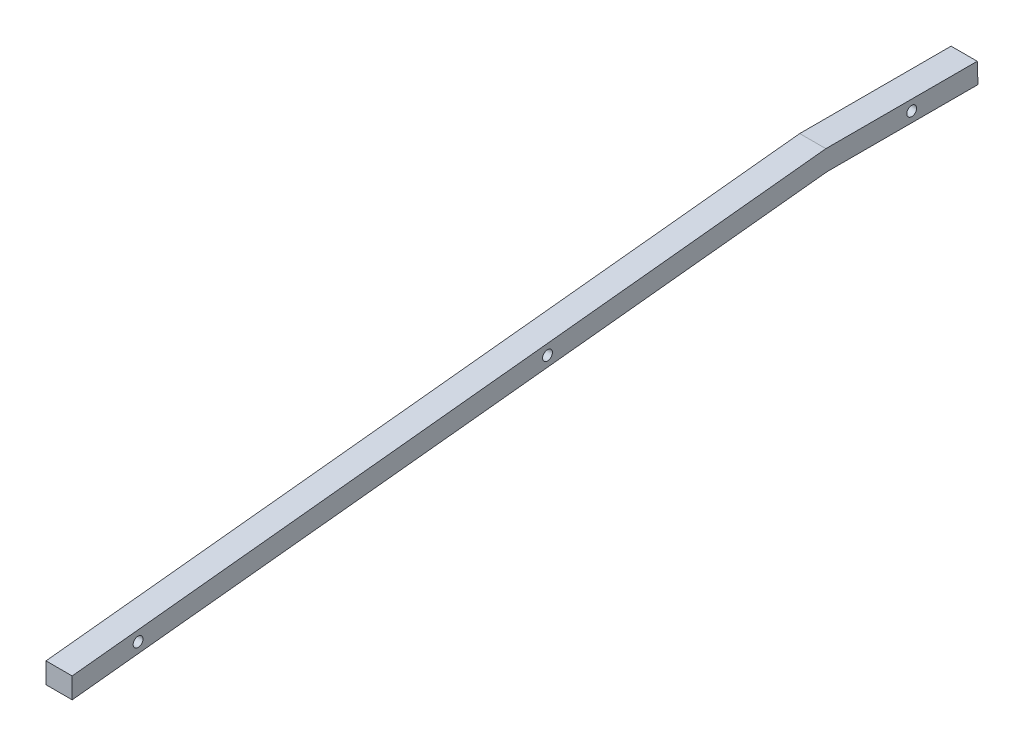
from build123d import *

# Parameters (mm, degrees)
BOSS_EXTRUDE1_DEPTH                 = 6.35
F_3_32_0_09375_DIAMETER_HOLE1_D     = 2.38125
F_3_32_0_09375_DIAMETER_HOLE1_DEPTH = 8
F_3_32_0_09375_DIAMETER_HOLE1_TIP   = 0.715399675


with BuildPart() as part:
    # Sketch8 → Boss-Extrude1 (new body)
    with BuildSketch(Plane(origin=(0, 0, 0), x_dir=(0, 0, -1), z_dir=(1, 0, 0))):
        Polygon((-84.484414223, -6.159266037), (-84.484414223, -11.187214329), (98.786832766, 8.217533909), (135.378560096, 8.21091712), (135.196228698, 13.21091712), (98.450522899, 13.209873734), align=None)
    extrude(amount=BOSS_EXTRUDE1_DEPTH)

    # 3/32 (0.09375) Diameter Hole1
    with Locations(Plane(origin=(6.35, 0, 0), x_dir=(0, 0, -1), z_dir=(1, 0, 0))):
        with Locations((-68.484414223, -6.979161178), (30.889527611, 3.542545606), (119.276776099, 10.71046509)):
            Hole(F_3_32_0_09375_DIAMETER_HOLE1_D / 2, depth=F_3_32_0_09375_DIAMETER_HOLE1_DEPTH)
            with Locations((0, 0, -(F_3_32_0_09375_DIAMETER_HOLE1_DEPTH + F_3_32_0_09375_DIAMETER_HOLE1_TIP / 2))):  # 118° drill point
                Cone(0, F_3_32_0_09375_DIAMETER_HOLE1_D / 2, F_3_32_0_09375_DIAMETER_HOLE1_TIP, mode=Mode.SUBTRACT)


solid = part.part
